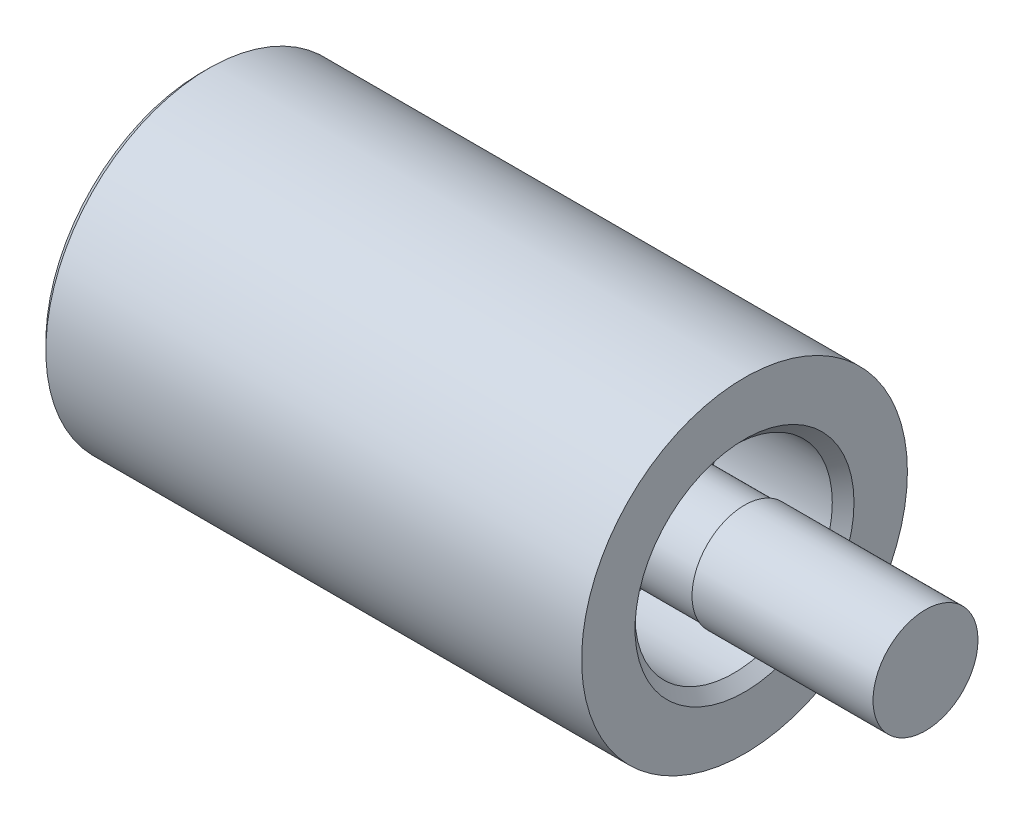
from build123d import *

# Parameters (mm, degrees)
SKETCH_1_R          = 9
EXTRUDE_1_DEPTH     = 20
EXTRUDE_START       = 10
SKETCH_2_R          = 9
EXTRUDE_2_DEPTH     = 10
SKETCH_4_R          = 5.45
SKETCH_4_R_2        = 2.8
CUT_EXTRUDE_1_DEPTH = 7
SKETCH_5_R          = 2.9
EXTRUDE_3_DEPTH     = 10
CHAMFER_1_SIZE      = 0.6
CHAMFER_2_SIZE      = 0.4
FILLET_3_R          = 0.4


with BuildPart() as part:
    # 草图1 → 凸台-拉伸1 (new body)
    with BuildSketch(Plane(origin=(0, 0, 0), x_dir=(0, 0, -1), z_dir=(1, 0, 0))):
        Circle(SKETCH_1_R)
        with BuildLine():
            Line((-2.2, 4.4), (2.2, 4.4))
            Line((2.2, 4.4), (2.2, 6.8556546))
            ThreePointArc((2.2, 6.8556546), (0, -7.2), (-2.2, 6.8556546))
            Line((-2.2, 6.8556546), (-2.2, 4.4))
        make_face(mode=Mode.SUBTRACT)
    extrude(amount=-EXTRUDE_1_DEPTH)

    # 草图2 → 凸台-拉伸2 (add)
    with BuildSketch(Plane(origin=(0, 0, 0), x_dir=(0, 0, -1), z_dir=(1, 0, 0)).offset(EXTRUDE_START)):
        Circle(SKETCH_2_R)
    extrude(amount=-EXTRUDE_2_DEPTH)

    # 草图4 → 切除-拉伸1 (cut)
    with BuildSketch(Plane(origin=(10, 0, 0), x_dir=(0, 0, -1), z_dir=(1, 0, 0))):
        Circle(SKETCH_4_R)
        Circle(SKETCH_4_R_2, mode=Mode.SUBTRACT)
    extrude(amount=-CUT_EXTRUDE_1_DEPTH, mode=Mode.SUBTRACT)

    # 草图5 → 凸台-拉伸3 (add)
    with BuildSketch(Plane(origin=(10, 0, 0), x_dir=(0, 0, -1), z_dir=(1, 0, 0))):
        Circle(SKETCH_5_R)
    extrude(amount=EXTRUDE_3_DEPTH)

    # Chamfer 1
    chamfer_1_edges = [part.edges().sort_by_distance(p)[0] for p in [
        (10, 0, 5.45),
    ]]
    chamfer(chamfer_1_edges, length=CHAMFER_1_SIZE)

    # Chamfer 2
    chamfer_2_edges = [part.edges().sort_by_distance(p)[0] for p in [
        (-20, 0, 9),
        (-20, 5.6278273, 2.2),
        (-20, 4.4, 0),
        (-20, 5.6278273, -2.2),
        (-20, -7.2, 0),
    ]]
    chamfer(chamfer_2_edges, length=CHAMFER_2_SIZE)

    # 圆角3
    fillet_3_edges = [part.edges().sort_by_distance(p)[0] for p in [
        (-9.8, 4.4, 2.2),
        (-9.8, 4.4, -2.2),
    ]]
    fillet(fillet_3_edges, radius=FILLET_3_R)


solid = part.part
